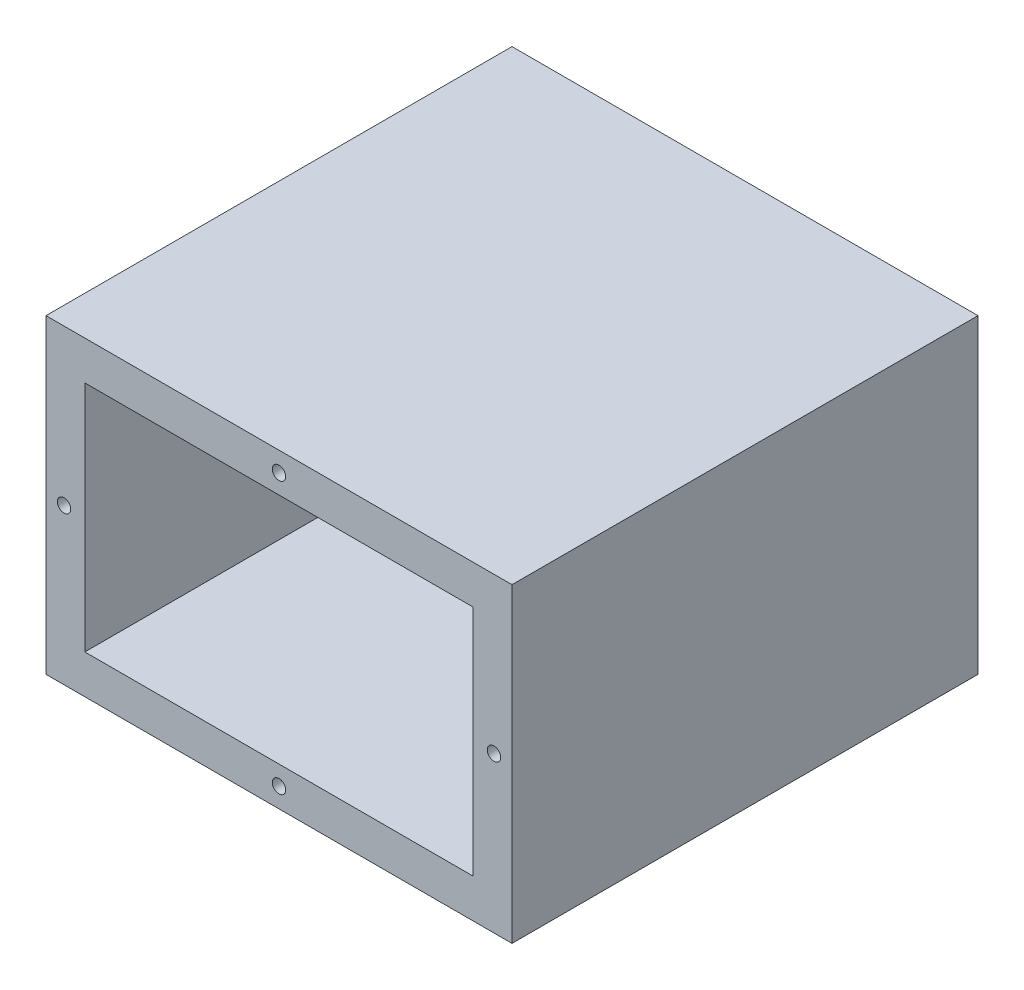
from build123d import *

# Parameters (mm, degrees)
SKETCH1_W           = 76.2
SKETCH1_H           = 50.8
BOSS_EXTRUDE1_DEPTH = 76.2
SKETCH2_W           = 63.5
SKETCH2_H           = 38.1
CUT_EXTRUDE1_DEPTH  = 71.12
SKETCH3_R           = 3.175
SKETCH3_R_2         = 1.651
CUT_EXTRUDE2_DEPTH  = 48.26
SKETCH4_R           = 1.0922
CUT_EXTRUDE3_DEPTH  = 15.875


with BuildPart() as part:
    # Sketch1 → Boss-Extrude1 (new body)
    with BuildSketch(Plane.XY):
        Rectangle(SKETCH1_W, SKETCH1_H)
    extrude(amount=BOSS_EXTRUDE1_DEPTH)

    # Sketch2 → Cut-Extrude1 (cut)
    with BuildSketch(Plane.XY.offset(76.2)):
        Rectangle(SKETCH2_W, SKETCH2_H)
    extrude(amount=-CUT_EXTRUDE1_DEPTH, mode=Mode.SUBTRACT)

    # Sketch3 → Cut-Extrude2 (cut)
    with BuildSketch(Plane.XY.offset(5.08)):
        Circle(SKETCH3_R)
        with Locations((-16.51, 0)):
            Circle(SKETCH3_R_2)
    extrude(amount=-CUT_EXTRUDE2_DEPTH, mode=Mode.SUBTRACT)

    # Sketch4 → Cut-Extrude3 (cut)
    with BuildSketch(Plane.XY.offset(76.2)):
        with Locations((-35.149835373, 0)):
            Circle(SKETCH4_R)
        with Locations(Location((35.149835373, 0, 0), (0, 0, 180))):
            Circle(SKETCH4_R)
        with Locations((0, 22.186517988)):
            Circle(SKETCH4_R)
        with Locations(Location((0, -22.186517988, 0), (0, 0, 180))):
            Circle(SKETCH4_R)
    extrude(amount=-CUT_EXTRUDE3_DEPTH, mode=Mode.SUBTRACT)


solid = part.part
